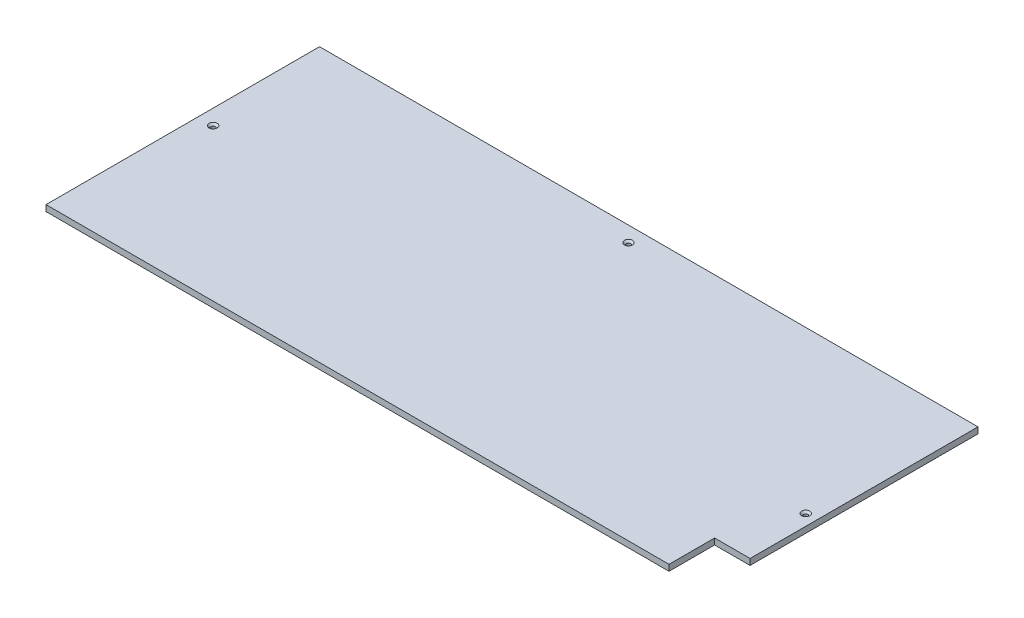
from build123d import *

# Parameters (mm, degrees)
SKETCH1_W                                       = 650
SKETCH1_H                                       = 270
BOSS_EXTRUDE1_DEPTH                             = 6
SKETCH2_W                                       = 35
SKETCH2_H                                       = 45
CUT_EXTRUDE1_DEPTH                              = 358.995810031
CSK_FOR_M4_FLAT_HEAD_MACHINE_SCREW1_D           = 4.2
CSK_FOR_M4_FLAT_HEAD_MACHINE_SCREW1_CSINK_D     = 8
CSK_FOR_M4_FLAT_HEAD_MACHINE_SCREW1_CSINK_ANGLE = 90


with BuildPart() as part:
    # Sketch1 → Boss-Extrude1 (new body)
    with BuildSketch(Plane(origin=(0, 0, 0), x_dir=(1, 0, 0), z_dir=(0, 1, 0))):
        with Locations((0, -15)):
            Rectangle(SKETCH1_W, SKETCH1_H)
    extrude(amount=BOSS_EXTRUDE1_DEPTH)

    # Sketch2 → Cut-Extrude1 (cut, through all)
    with BuildSketch(Plane(origin=(0, 6, 0), x_dir=(1, 0, 0), z_dir=(0, 1, 0))):
        with Locations((307.5, -127.5)):
            Rectangle(SKETCH2_W, SKETCH2_H)
        Polygon((337.933434696, -105), (325, -105), (325, -150), (290, -150), (290, -185.199938578), (337.933434696, -185.199938578), align=None)
    extrude(amount=-CUT_EXTRUDE1_DEPTH, mode=Mode.SUBTRACT)

    # CSK for M4 Flat Head Machine Screw1 (through all)
    with Locations(Plane(origin=(0, 6, 0), x_dir=(1, 0, 0), z_dir=(0, 1, 0))):
        with Locations((-310, 0), (-5, 105), (314, -39)):
            CounterSinkHole(CSK_FOR_M4_FLAT_HEAD_MACHINE_SCREW1_D / 2, CSK_FOR_M4_FLAT_HEAD_MACHINE_SCREW1_CSINK_D / 2, counter_sink_angle=CSK_FOR_M4_FLAT_HEAD_MACHINE_SCREW1_CSINK_ANGLE)


solid = part.part
